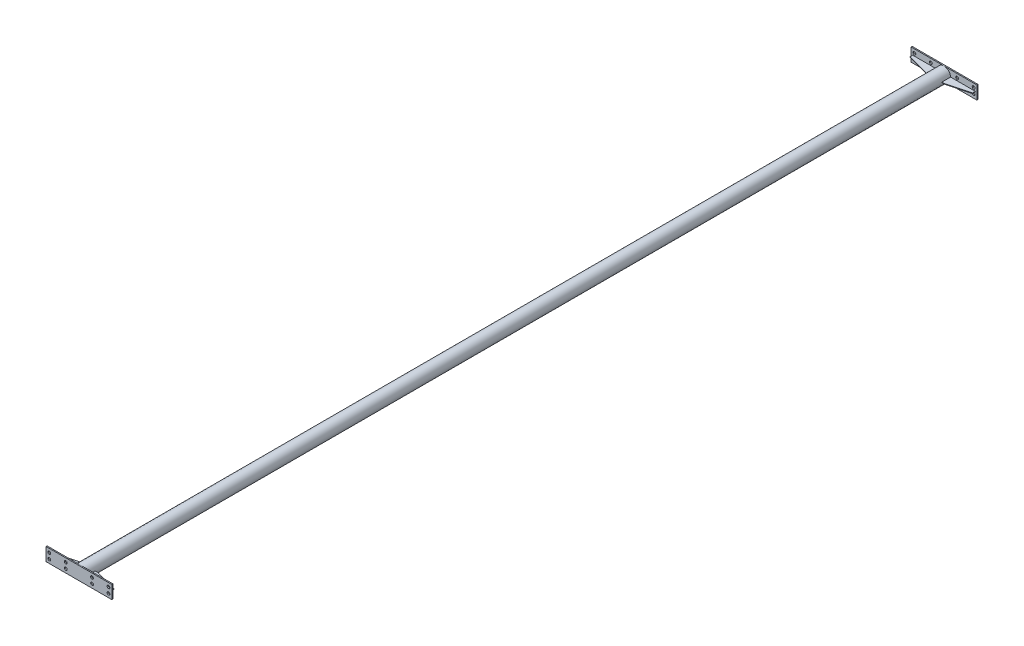
from build123d import *

# Parameters (mm, degrees)
SKETCH1_W               = 600
SKETCH1_H               = 120
BOSS_EXTRUDE1_DEPTH     = 10
SKETCH2_R               = 60
BOSS_EXTRUDE2_DEPTH     = 7880
BOSS_EXTRUDE3_DEPTH     = 2.5
BOSS_EXTRUDE3_2_DEPTH   = 2.5
CUT_EXTRUDE1_DEPTH      = 3962.830385062
CUT_EXTRUDE1_DEPTH_BACK = 3962.830385062
SKETCH6_R               = 13


with BuildPart() as part:
    # Sketch1 → Boss-Extrude1 (new body)
    with BuildSketch(Plane.XY):
        Rectangle(SKETCH1_W, SKETCH1_H)
    extrude(amount=BOSS_EXTRUDE1_DEPTH)


with BuildPart() as body_2:
    # Sketch2 → Boss-Extrude2 (new body)
    with BuildSketch(Plane.XY.offset(10)):
        with Locations(Location((0, 0, 0), (0, 0, 180))):
            Circle(SKETCH2_R)
    extrude(amount=BOSS_EXTRUDE2_DEPTH)


with BuildPart() as body_3:
    # Sketch4 → Boss-Extrude3 (new, symmetric)
    with BuildSketch(Plane(origin=(0, 0, 0), x_dir=(1, 0, 0), z_dir=(0, 1, 0))):
        Polygon((285, -10), (285, -35), (85, -88.589838486), (60, -88.589838486), (60, -10), align=None)
    extrude(amount=BOSS_EXTRUDE3_DEPTH, both=True)


with BuildPart() as body_4:
    # Sketch4 → Boss-Extrude3 2 (new, symmetric)
    with BuildSketch(Plane(origin=(0, 0, 0), x_dir=(1, 0, 0), z_dir=(0, 1, 0))):
        Polygon((-60, -10), (-285, -10), (-285, -35), (-85, -88.589838486), (-60, -88.589838486), align=None)
    extrude(amount=BOSS_EXTRUDE3_2_DEPTH, both=True)


with BuildPart() as body_5:
    # Mirror1: mirrored copy
    add(part.part.mirror(Plane(origin=(0, 0, 3950), x_dir=(1, 0, 0), z_dir=(0, 0, -1))))


with BuildPart() as body_6:
    # Mirror1 2: mirrored copy
    add(body_4.part.mirror(Plane(origin=(0, 0, 3950), x_dir=(1, 0, 0), z_dir=(0, 0, -1))))


with BuildPart() as body_7:
    # Mirror1 3: mirrored copy
    add(body_3.part.mirror(Plane(origin=(0, 0, 3950), x_dir=(1, 0, 0), z_dir=(0, 0, -1))))


with BuildPart() as cut_extrude1_tool:
    # Sketch6 → Cut-Extrude1 (new, two sides: drawn at the far end of the back side and taken through both)
    with BuildSketch(Plane(origin=(0, 0, 3950), x_dir=(-1, 0, 0), z_dir=(0, 0, -1)).offset(-CUT_EXTRUDE1_DEPTH_BACK)):
        with Locations((270, 25)):
            Circle(SKETCH6_R)
        with Locations((270, -25)):
            Circle(SKETCH6_R)
        with Locations((120, 25)):
            Circle(SKETCH6_R)
        with Locations((120, -25)):
            Circle(SKETCH6_R)
        with Locations((-120, -25)):
            Circle(SKETCH6_R)
        with Locations((-120, 25)):
            Circle(SKETCH6_R)
        with Locations((-270, -25)):
            Circle(SKETCH6_R)
        with Locations((-270, 25)):
            Circle(SKETCH6_R)
    extrude(amount=CUT_EXTRUDE1_DEPTH + CUT_EXTRUDE1_DEPTH_BACK)


with BuildPart() as part_1:
    add(part.part)

    # Cut-Extrude1: cut by cut_extrude1_tool
    add(cut_extrude1_tool.part, mode=Mode.SUBTRACT)


with BuildPart() as body_5_1:
    add(body_5.part)

    # Cut-Extrude1: cut by cut_extrude1_tool
    add(cut_extrude1_tool.part, mode=Mode.SUBTRACT)


solid = Compound([body_2.part, body_3.part, body_4.part, body_6.part, body_7.part, part_1.part, body_5_1.part])
